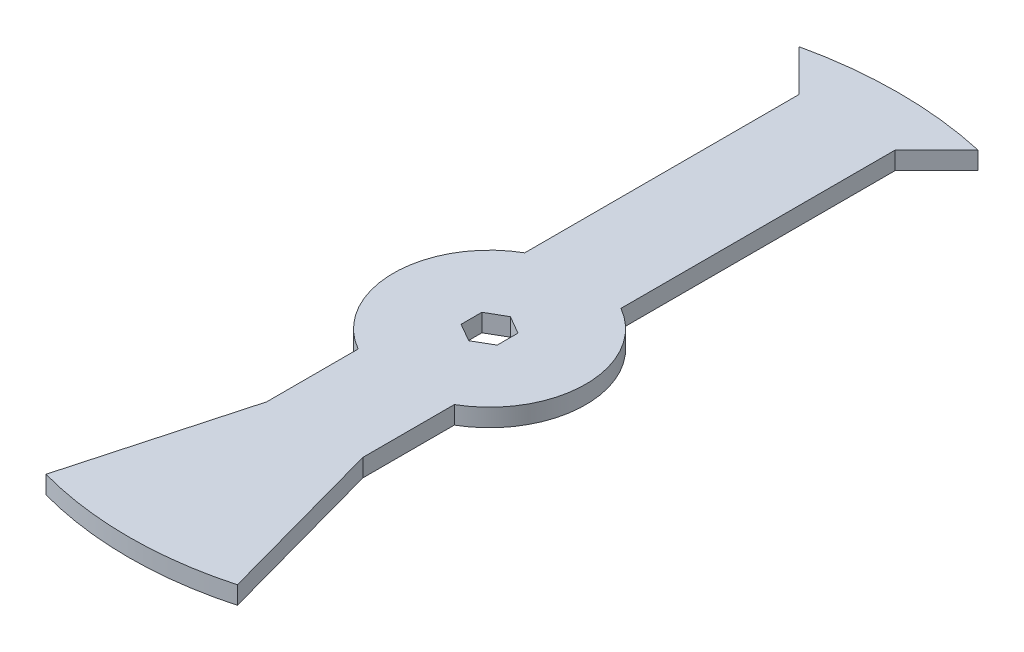
from build123d import *

# Parameters (mm, degrees)
BOSS_EXTRUDE1_DEPTH = 4.699
CUT_EXTRUDE1_REACH  = 112.997


with BuildPart() as part:
    # Sketch2 → Boss-Extrude1 (new body)
    with BuildSketch(Plane(origin=(0, 0, 0), x_dir=(1, 0, 0), z_dir=(0, 1, 0))):
        with BuildLine():
            Line((12.7, 0), (-12.7, 0))
            Line((-12.7, 0), (-12.7, -21.997045256))
            Line((-12.7, -21.997045256), (-12.7, -46.157401043))
            Line((-12.7, -46.157401043), (-12.7, -94.399536545))
            ThreePointArc((-12.7, -94.399536545), (0, -95.25), (12.7, -94.399536545))
            Line((12.7, -94.399536545), (12.7, -46.157401043))
            Line((12.7, -46.157401043), (12.7, -21.997045256))
            Line((12.7, -21.997045256), (12.7, 0))
        make_face()
        with BuildLine():
            Line((-12.7, -94.399536545), (-12.7, -46.157401043))
            Line((-12.7, -46.157401043), (-25.268575407, -91.837147151))
            ThreePointArc((-25.268575407, -91.837147151), (-19.027470653, -93.330155151), (-12.7, -94.399536545))
        make_face()
        with BuildLine():
            Line((25.268575407, -91.837147151), (12.7, -46.157401043))
            Line((12.7, -46.157401043), (12.7, -94.399536545))
            ThreePointArc((12.7, -94.399536545), (19.027470653, -93.330155151), (25.268575407, -91.837147151))
        make_face()
        with BuildLine():
            Line((12.7, 21.997045256), (12.7, 0))
            Line((12.7, 0), (12.7, -21.997045256))
            ThreePointArc((12.7, -21.997045256), (25.4, 0), (12.7, 21.997045256))
        make_face()
        with BuildLine():
            Line((-12.7, -21.997045256), (-12.7, 0))
            Line((-12.7, 0), (-12.7, 21.997045256))
            ThreePointArc((-12.7, 21.997045256), (-25.4, 0), (-12.7, -21.997045256))
        make_face()
        with BuildLine():
            Line((-12.7, 21.997045256), (-12.7, 0))
            Line((-12.7, 0), (12.7, 0))
            Line((12.7, 0), (12.7, 21.997045256))
            Line((12.7, 21.997045256), (12.7, 94.399536545))
            Line((12.7, 94.399536545), (23.631994126, 105.331530672))
            ThreePointArc((23.631994126, 105.331530672), (0, 107.95), (-23.631994126, 105.331530672))
            Line((-23.631994126, 105.331530672), (-12.7, 94.399536545))
            Line((-12.7, 94.399536545), (-12.7, 21.997045256))
        make_face()
    extrude(amount=BOSS_EXTRUDE1_DEPTH)

    # Sketch3 → Cut-Extrude1 (cut, up to next)
    with BuildSketch(Plane(origin=(0, 4.699, 0), x_dir=(1, 0, 0), z_dir=(0, 1, 0)), mode=Mode.PRIVATE) as cut_extrude1_sk1:
        Polygon((-4.7625, 2.749630657), (-4.7625, -2.749630657), (0, -5.499261314), (4.7625, -2.749630657), (4.7625, 2.749630657), (0, 5.499261314), align=None)
    cut_extrude1_tool1 = extrude(cut_extrude1_sk1.sketch, amount=-CUT_EXTRUDE1_REACH, mode=Mode.PRIVATE) & part.part
    add(cut_extrude1_tool1.solids().sort_by_distance((0, 4.699, 0))[0], mode=Mode.SUBTRACT)


solid = part.part
